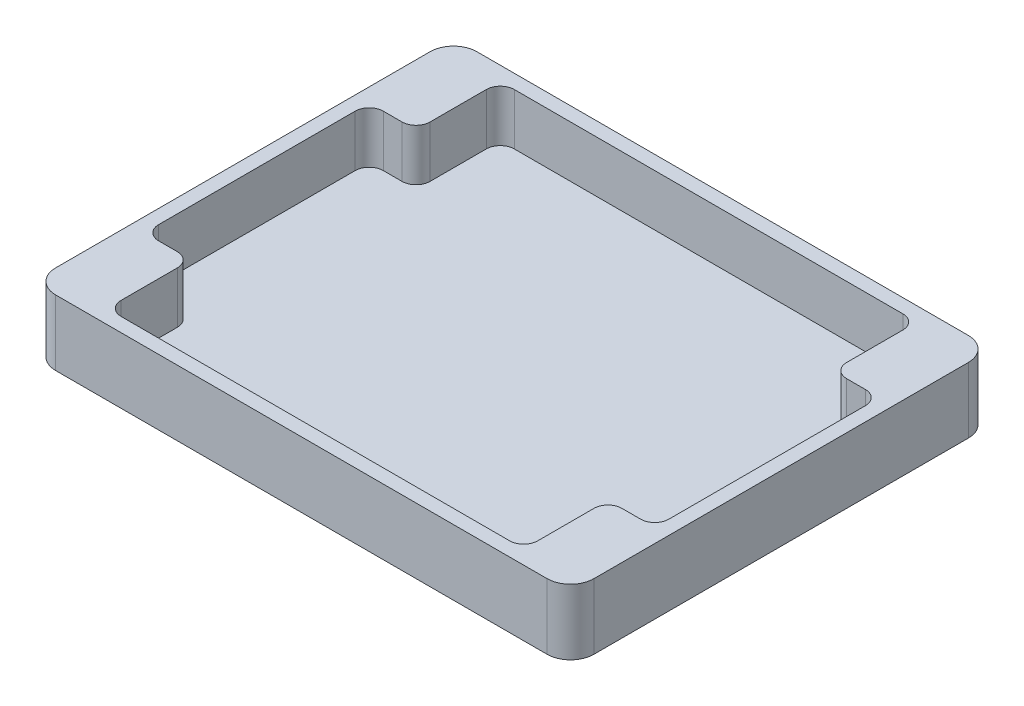
from build123d import *

# Parameters (mm, degrees)
SKETCH1_W           = 115
SKETCH1_H           = 90
BOSS_EXTRUDE1_DEPTH = 14
SKETCH3_W           = 109
SKETCH3_H           = 84
CUT_EXTRUDE1_DEPTH  = 11
SKETCH4_W           = 10
SKETCH4_H           = 18
BOSS_EXTRUDE2_DEPTH = 11
FILLET1_R           = 3
FILLET2_R           = 5


with BuildPart() as part:
    # Sketch1 → Boss-Extrude1 (new body)
    with BuildSketch(Plane(origin=(0, 0, 0), x_dir=(1, 0, 0), z_dir=(0, 1, 0))):
        with Locations((57.5, 45)):
            Rectangle(SKETCH1_W, SKETCH1_H)
    extrude(amount=BOSS_EXTRUDE1_DEPTH)

    # Sketch3 → Cut-Extrude1 (cut)
    with BuildSketch(Plane(origin=(0, 14, 0), x_dir=(1, 0, 0), z_dir=(0, 1, 0))):
        with Locations((57.5, 45)):
            Rectangle(SKETCH3_W, SKETCH3_H)
    extrude(amount=-CUT_EXTRUDE1_DEPTH, mode=Mode.SUBTRACT)

    # Sketch4 → Boss-Extrude2 (add)
    with BuildSketch(Plane(origin=(0, 3, 0), x_dir=(1, 0, 0), z_dir=(0, 1, 0))):
        with Locations((8, 78)):
            Rectangle(SKETCH4_W, SKETCH4_H)
        with Locations((107, 78)):
            Rectangle(SKETCH4_W, SKETCH4_H)
        with Locations((107, 12)):
            Rectangle(SKETCH4_W, SKETCH4_H)
        with Locations((8, 12)):
            Rectangle(SKETCH4_W, SKETCH4_H)
    extrude(amount=BOSS_EXTRUDE2_DEPTH)

    # Fillet1
    fillet1_edges = [part.edges().sort_by_distance(p)[0] for p in [
        (13, 8.5, -87),
        (13, 8.5, -69),
        (3, 8.5, -69),
        (102, 8.5, -69),
        (102, 8.5, -87),
        (112, 8.5, -69),
        (102, 8.5, -21),
        (112, 8.5, -21),
        (102, 8.5, -3),
        (13, 8.5, -21),
        (13, 8.5, -3),
        (3, 8.5, -21),
    ]]
    fillet(fillet1_edges, radius=FILLET1_R)

    # Fillet2
    fillet2_edges = [part.edges().sort_by_distance(p)[0] for p in [
        (0, 7, -90),
        (115, 7, -90),
        (115, 7, 0),
        (0, 7, 0),
    ]]
    fillet(fillet2_edges, radius=FILLET2_R)


solid = part.part
